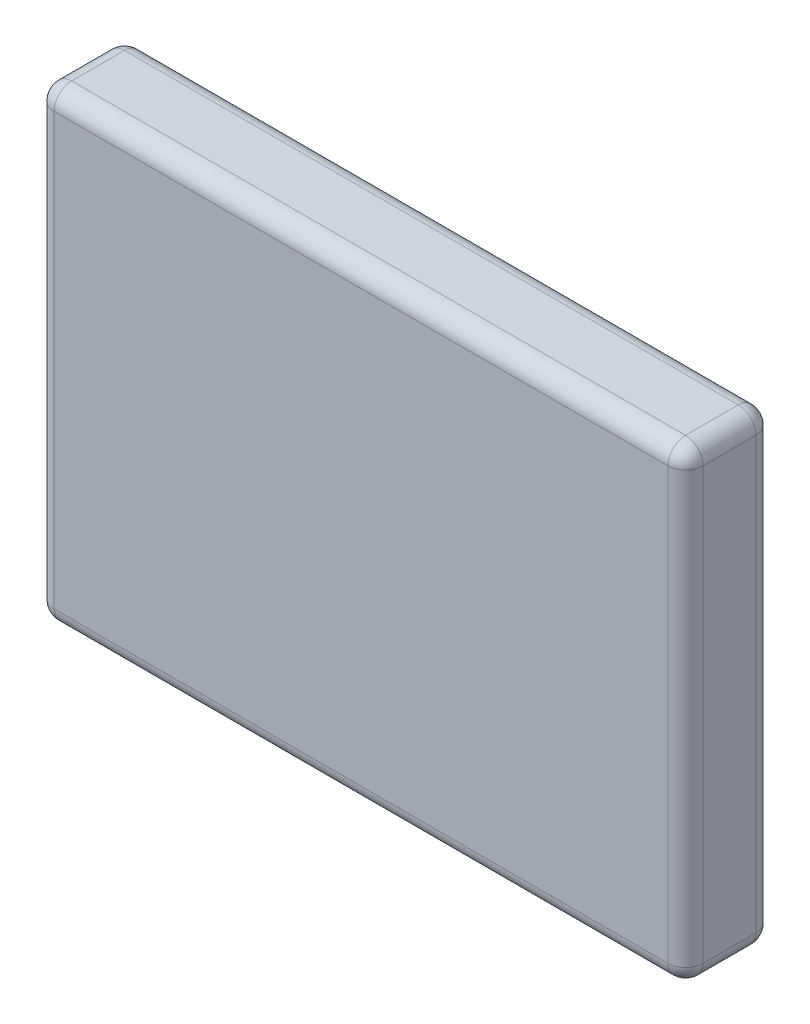
from build123d import *

# Parameters (mm, degrees)
SKETCH1_W           = 36.9
SKETCH1_H           = 26.5
BOSS_EXTRUDE1_DEPTH = 5
FILLET1_R           = 1


with BuildPart() as part:
    # Sketch1 → Boss-Extrude1 (new body)
    with BuildSketch(Plane.XY):
        with Locations((18.45, 13.25)):
            Rectangle(SKETCH1_W, SKETCH1_H)
    extrude(amount=BOSS_EXTRUDE1_DEPTH)

    # Fillet1
    fillet1_edges = [part.edges().sort_by_distance(p)[0] for p in [
        (36.9, 13.25, 5),
        (18.45, 26.5, 5),
        (0, 13.25, 5),
        (18.45, 26.5, 0),
        (36.9, 13.25, 0),
        (18.45, 0, 0),
        (0, 13.25, 0),
        (0, 26.5, 2.5),
        (36.9, 26.5, 2.5),
        (36.9, 0, 2.5),
        (0, 0, 2.5),
        (18.45, 0, 5),
    ]]
    fillet(fillet1_edges, radius=FILLET1_R)


solid = part.part
